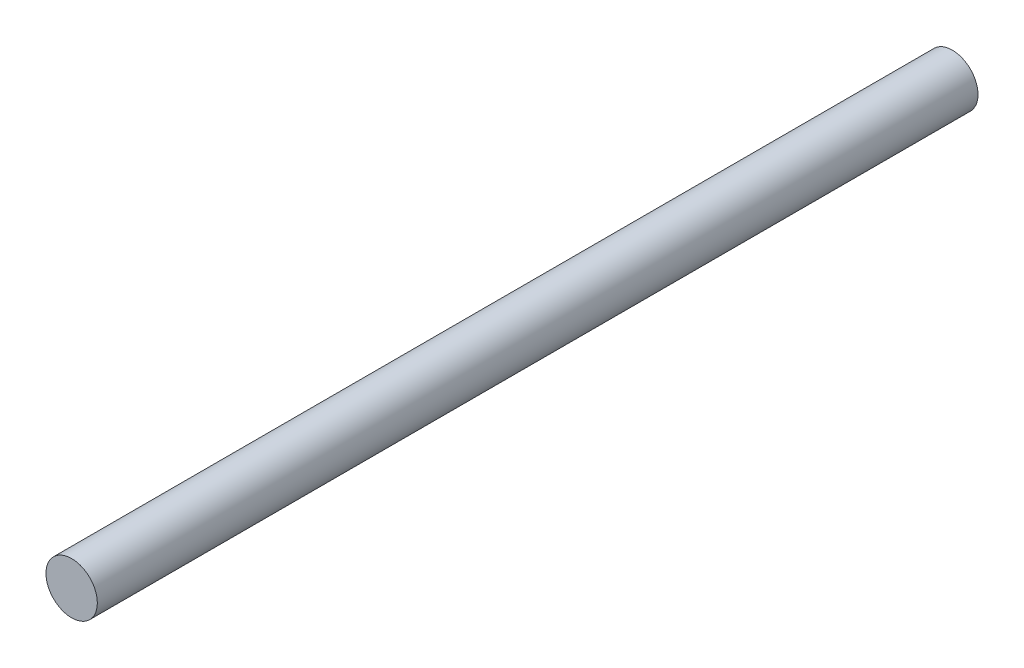
from build123d import *

# Parameters (mm, degrees)
SKETCH1_R           = 7
BOSS_EXTRUDE1_DEPTH = 240


with BuildPart() as part:
    # Sketch1 → Boss-Extrude1 (new body)
    with BuildSketch(Plane.XY):
        Circle(SKETCH1_R)
    extrude(amount=BOSS_EXTRUDE1_DEPTH)


solid = part.part
